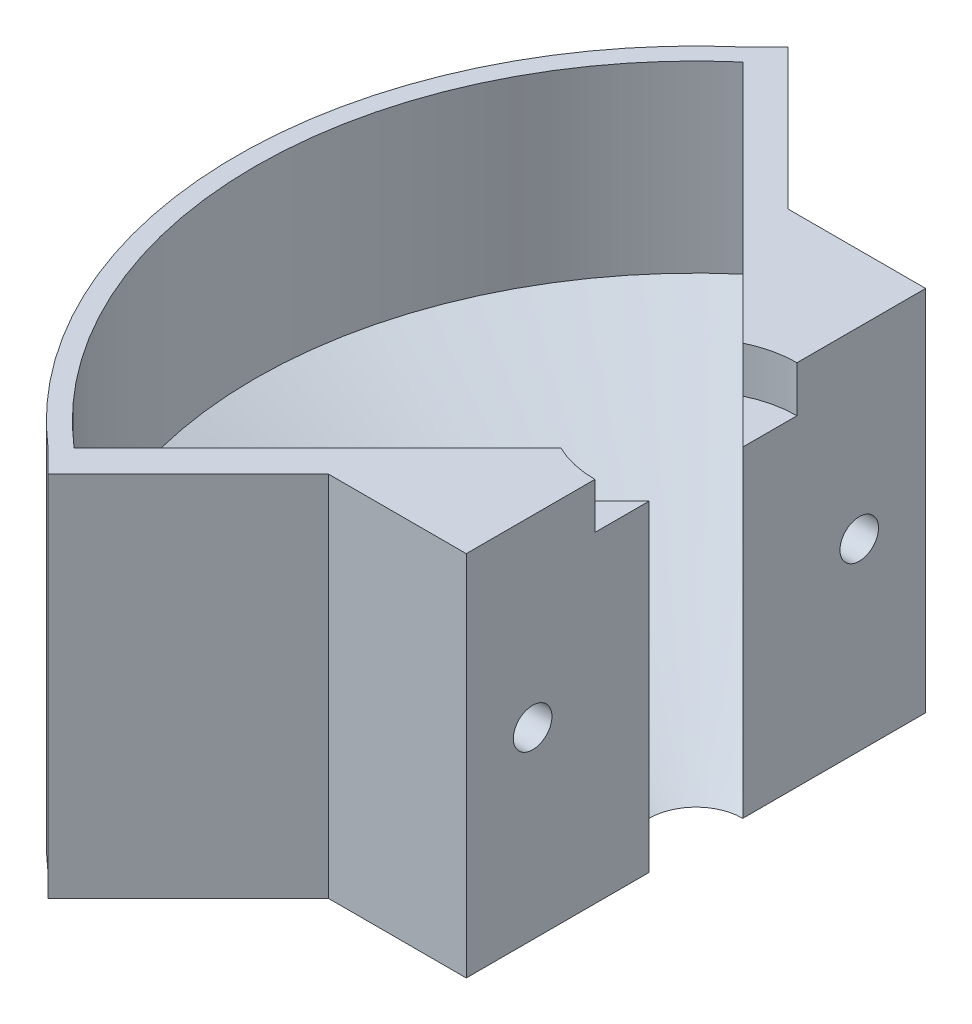
from build123d import *

# Parameters (mm, degrees)
REVOLVE1_ANGLE           = 90
REVOLVE1_OTHER_WAY_ANGLE = 90
BOSS_EXTRUDE3_DEPTH      = 50.8
CUT_EXTRUDE1_REACH       = 105.175
BOSS_EXTRUDE4_DEPTH      = 50.8
SKETCH6_R                = 13.97
CUT_EXTRUDE2_DEPTH       = 6.35
SKETCH7_R                = 2.665
CUT_EXTRUDE3_DEPTH       = 8.89


with BuildPart() as part:
    # Sketch1 → Revolve1 (revolve)
    with BuildSketch(Plane.XY):
        Polygon((-63.5, 50.8), (-63.5, 0), (-6.477, 0), (-60.96, 25.405840139), (-60.96, 50.8), align=None)
    revolve(axis=Axis((0, 0, 0), (0, 1, 0)), revolution_arc=REVOLVE1_ANGLE)

    # Sketch1 → Revolve1 other way (revolve)
    with BuildSketch(Plane.XY):
        Polygon((-63.5, 50.8), (-63.5, 0), (-6.477, 0), (-60.96, 25.405840139), (-60.96, 50.8), align=None)
    revolve(axis=Axis((0, 0, 0), (0, -1, 0)), revolution_arc=REVOLVE1_OTHER_WAY_ANGLE)

    # Sketch4 → Boss-Extrude3 (add)
    with BuildSketch(Plane(origin=(0, 0, 0), x_dir=(-1, 0, 0), z_dir=(0, -1, 0))):
        Polygon((19.05, 31.75), (0, 31.75), (0, 6.477), (19.05, 25.527), align=None)
        Polygon((19.05, -25.527), (0, -6.477), (0, -31.75), (19.05, -31.75), align=None)
    extrude(amount=-BOSS_EXTRUDE3_DEPTH)

    # Sketch4<3> → Cut-Extrude1 (cut, up to next)
    with BuildSketch(Plane(origin=(0, 0, 0), x_dir=(-1, 0, 0), z_dir=(0, -1, 0)), mode=Mode.PRIVATE) as cut_extrude1_sk1:
        with BuildLine():
            Line((0, 63.5), (0, 31.75))
            Line((0, 31.75), (19.05, 31.75))
            Line((19.05, 31.75), (19.05, 25.527))
            Line((19.05, 25.527), (41.545840095, 48.022840095))
            ThreePointArc((41.545840095, 48.022840095), (22.16753994, 59.505043257), (0, 63.5))
        make_face()
    cut_extrude1_tool1 = extrude(cut_extrude1_sk1.sketch, amount=-CUT_EXTRUDE1_REACH, mode=Mode.PRIVATE) & part.part
    # Sketch4<3> → Cut-Extrude1 (cut, up to next)
    with BuildSketch(Plane(origin=(0, 0, 0), x_dir=(-1, 0, 0), z_dir=(0, -1, 0)), mode=Mode.PRIVATE) as cut_extrude1_sk2:
        with BuildLine():
            Line((19.05, -31.75), (0, -31.75))
            Line((0, -31.75), (0, -63.5))
            ThreePointArc((0, -63.5), (22.16753994, -59.505043257), (41.545840095, -48.022840095))
            Line((41.545840095, -48.022840095), (19.05, -25.527))
            Line((19.05, -25.527), (19.05, -31.75))
        make_face()
    cut_extrude1_tool2 = extrude(cut_extrude1_sk2.sketch, amount=-CUT_EXTRUDE1_REACH, mode=Mode.PRIVATE) & part.part
    add(cut_extrude1_tool1.solids().sort_by_distance((-16.601878, 0, -46.365556))[0], mode=Mode.SUBTRACT)
    add(cut_extrude1_tool2.solids().sort_by_distance((-16.601878, 0, 46.365556))[0], mode=Mode.SUBTRACT)

    # Sketch5 → Boss-Extrude4 (add)
    with BuildSketch(Plane.XZ):
        Polygon((-41.545840095, 48.022840095), (-38.434340095, 51.134340095), (-19.05, 31.75), (-19.05, 25.527), align=None)
        Polygon((-41.545840095, -48.022840095), (-38.434340095, -51.134340095), (-19.05, -31.75), (-19.05, -25.527), align=None)
    extrude(amount=-BOSS_EXTRUDE4_DEPTH)

    # Sketch6 → Cut-Extrude2 (cut)
    with BuildSketch(Plane(origin=(0, 50.8, 0), x_dir=(1, 0, 0), z_dir=(0, 1, 0))):
        Circle(SKETCH6_R)
    extrude(amount=-CUT_EXTRUDE2_DEPTH, mode=Mode.SUBTRACT)

    # Sketch7 → Cut-Extrude3 (cut)
    with BuildSketch(Plane(origin=(0, 0, 0), x_dir=(0, 0, -1), z_dir=(1, 0, 0))):
        with Locations((-22.575, 25.4)):
            Circle(SKETCH7_R)
        with Locations((22.575, 25.4)):
            Circle(SKETCH7_R)
    extrude(amount=-CUT_EXTRUDE3_DEPTH, mode=Mode.SUBTRACT)


solid = part.part
